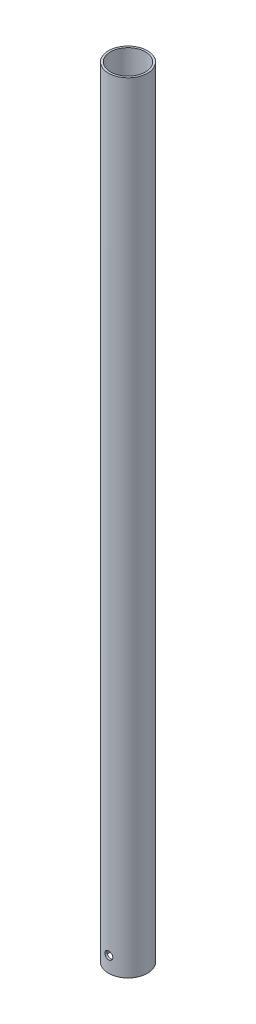
from build123d import *

# Parameters (mm, degrees)
SKETCH1_R               = 15.875
SKETCH1_R_2             = 14.224
BOSS_EXTRUDE1_DEPTH     = 635
CUT_EXTRUDE1_DEPTH      = 636.396751054
CUT_EXTRUDE1_DEPTH_BACK = 636.396751054
SKETCH2_R               = 3.175


with BuildPart() as part:
    # Sketch1 → Boss-Extrude1 (new body)
    with BuildSketch(Plane(origin=(0, 0, 0), x_dir=(1, 0, 0), z_dir=(0, 1, 0))):
        Circle(SKETCH1_R)
        Circle(SKETCH1_R_2, mode=Mode.SUBTRACT)
    extrude(amount=BOSS_EXTRUDE1_DEPTH)

    # Sketch2 → Cut-Extrude1 (cut, two sides: drawn at the far end of the back side and taken through both)
    with BuildSketch(Plane.XY.offset(-CUT_EXTRUDE1_DEPTH_BACK)):
        with Locations((0, 12.7)):
            Circle(SKETCH2_R)
    extrude(amount=CUT_EXTRUDE1_DEPTH + CUT_EXTRUDE1_DEPTH_BACK, mode=Mode.SUBTRACT)


solid = part.part
